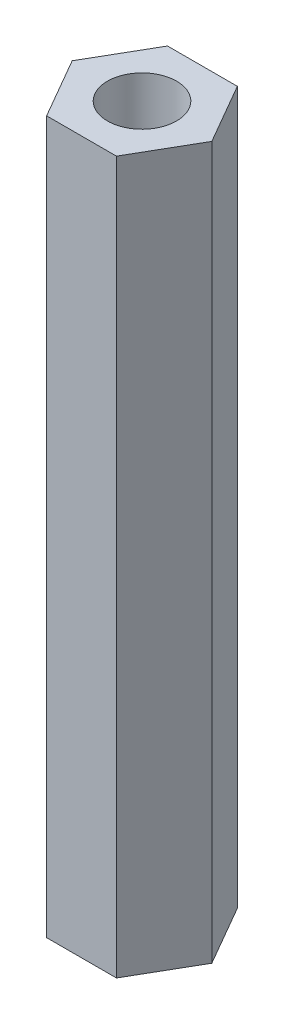
from build123d import *

# Parameters (mm, degrees)
SKETCH1_R           = 2
BOSS_EXTRUDE1_DEPTH = 41.2


with BuildPart() as part:
    # Sketch1 → Boss-Extrude1 (new body)
    with BuildSketch(Plane(origin=(0, 0, 0), x_dir=(1, 0, 0), z_dir=(0, 1, 0))):
        Polygon((-2.020725942, 3.5), (-4.041451884, 0), (-2.020725942, -3.5), (2.020725942, -3.5), (4.041451884, 0), (2.020725942, 3.5), align=None)
        with Locations(Location((0, 0, 0), (0, 0, 90))):
            Circle(SKETCH1_R, mode=Mode.SUBTRACT)
    extrude(amount=BOSS_EXTRUDE1_DEPTH)


solid = part.part
